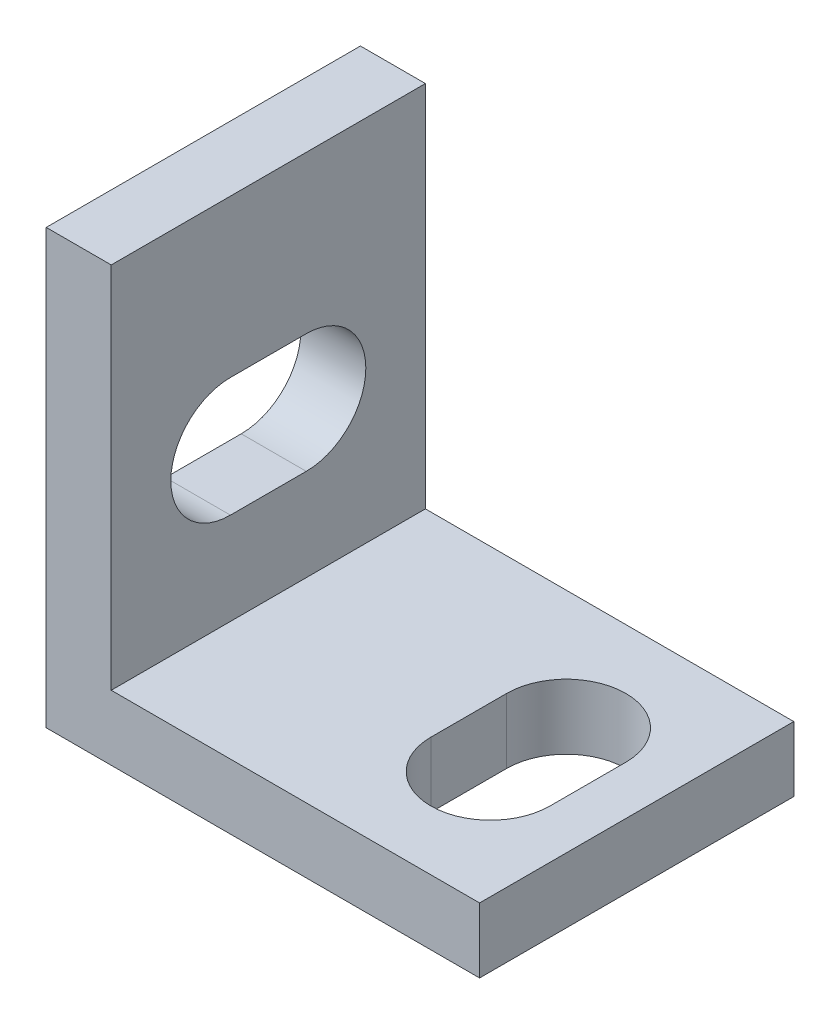
from build123d import *

# Parameters (mm, degrees)
EXTRUDE_THIN1_DEPTH = 14.5
CUT_EXTRUDE1_DEPTH  = 30.987497395
CUT_EXTRUDE2_DEPTH  = 30.987497395


with BuildPart() as part:
    # Sketch1 → Extrude-Thin1 (new body)
    with BuildSketch(Plane.XY):
        Polygon((0, 20), (0, 0), (20, 0), (20, 3), (3, 3), (3, 20), align=None)
    extrude(amount=EXTRUDE_THIN1_DEPTH)

    # Sketch2 → Cut-Extrude1 (cut, through all)
    with BuildSketch(Plane(origin=(3, 0, 0), x_dir=(0, 0, -1), z_dir=(1, 0, 0))):
        with BuildLine():
            Line((-5.5, 7.25), (-9, 7.25))
            ThreePointArc((-9, 7.25), (-11.75, 10), (-9, 12.75))
            Line((-9, 12.75), (-5.5, 12.75))
            ThreePointArc((-5.5, 12.75), (-2.75, 10), (-5.5, 7.25))
        make_face()
    extrude(amount=-CUT_EXTRUDE1_DEPTH, mode=Mode.SUBTRACT)

    # Sketch3 → Cut-Extrude2 (cut, through all)
    with BuildSketch(Plane(origin=(0, 3, 0), x_dir=(1, 0, 0), z_dir=(0, 1, 0))):
        with BuildLine():
            Line((12.25, -9), (12.25, -5.5))
            ThreePointArc((12.25, -5.5), (15, -2.75), (17.75, -5.5))
            Line((17.75, -5.5), (17.75, -9))
            ThreePointArc((17.75, -9), (15, -11.75), (12.25, -9))
        make_face()
    extrude(amount=-CUT_EXTRUDE2_DEPTH, mode=Mode.SUBTRACT)


solid = part.part
